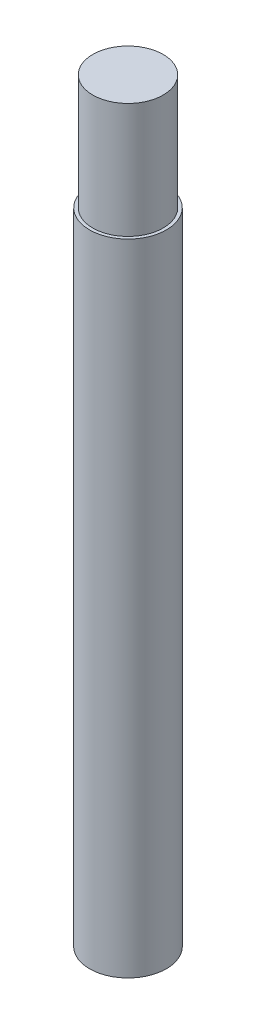
from build123d import *

# Parameters (mm, degrees)
SKETCH1_R           = 3
BOSS_EXTRUDE1_DEPTH = 50
SKETCH2_R           = 2.75
BOSS_EXTRUDE2_DEPTH = 9


with BuildPart() as part:
    # Sketch1 → Boss-Extrude1 (new body)
    with BuildSketch(Plane(origin=(0, 0, 0), x_dir=(1, 0, 0), z_dir=(0, 1, 0))):
        Circle(SKETCH1_R)
    extrude(amount=BOSS_EXTRUDE1_DEPTH)

    # Sketch2 → Boss-Extrude2 (add)
    with BuildSketch(Plane(origin=(0, 50, 0), x_dir=(1, 0, 0), z_dir=(0, 1, 0))):
        Circle(SKETCH2_R)
    extrude(amount=BOSS_EXTRUDE2_DEPTH)


solid = part.part
